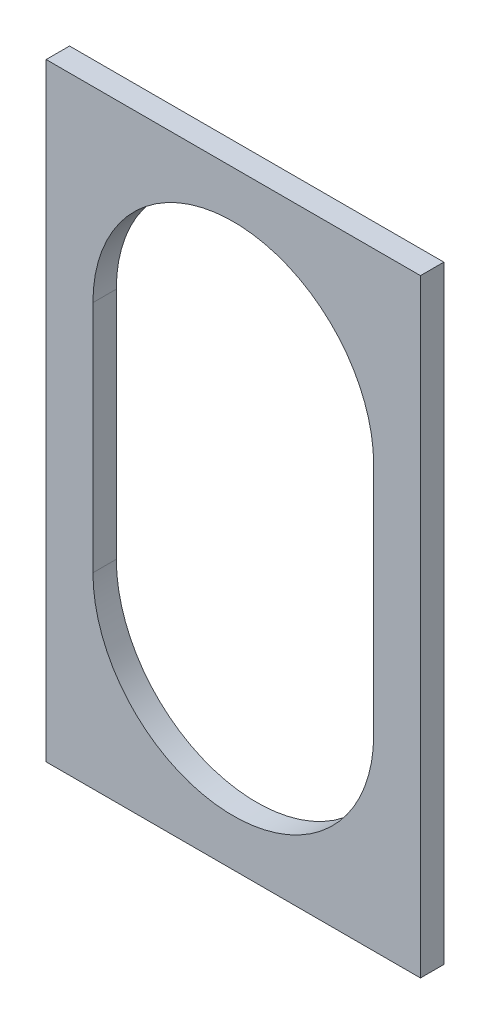
from build123d import *

# Parameters (mm, degrees)
SKETCH_1_W      = 80
SKETCH_1_H      = 130
EXTRUDE_1_DEPTH = 5


with BuildPart() as part:
    # Эскиз1 → Бобышка-Вытянуть1 (new body)
    with BuildSketch(Plane.XY):
        Rectangle(SKETCH_1_W, SKETCH_1_H)
        with BuildLine():
            Line((30, 25), (30, -25))
            ThreePointArc((30, -25), (0, -55), (-30, -25))
            Line((-30, -25), (-30, 25))
            ThreePointArc((-30, 25), (0, 55), (30, 25))
        make_face(mode=Mode.SUBTRACT)
    extrude(amount=EXTRUDE_1_DEPTH)


solid = part.part
